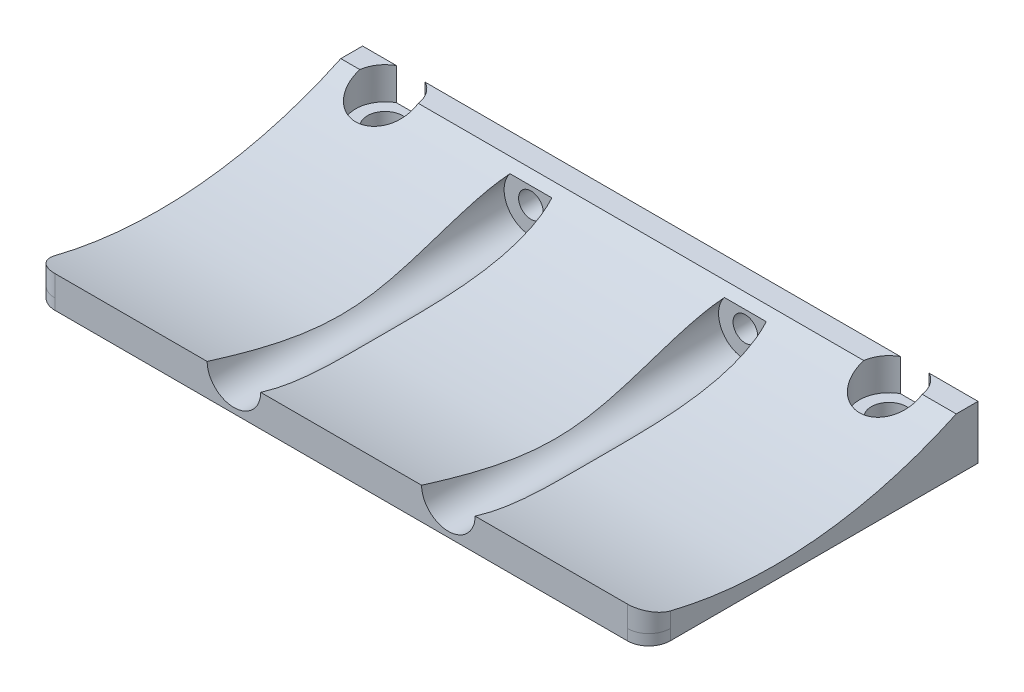
from build123d import *

# Parameters (mm, degrees)
SKETCH1_W           = 57.4
SKETCH1_H           = 33
SKETCH1_R           = 1.65
BOSS_EXTRUDE1_DEPTH = 1
CUT_EXTRUDE1_REACH  = 68.218
SKETCH2_W           = 57.4
SKETCH2_H           = 2.3
BOSS_EXTRUDE2_DEPTH = 57.4
FILLET1_R           = 2
BOSS_EXTRUDE3_DEPTH = 57.4
SKETCH4_R           = 1.65
CUT_EXTRUDE2_DEPTH  = 2
CUT_EXTRUDE3_REACH  = 67.163
SKETCH5_R           = 2.75
SKETCH6_R           = 1.15
CUT_EXTRUDE4_DEPTH  = 3
SKETCH9_R           = 2.5
CUT_EXTRUDE5_DEPTH  = 64.930040028
FILLET2_R           = 2


with BuildPart() as part:
    # Sketch1 → Boss-Extrude1 (new body)
    with BuildSketch(Plane(origin=(0, 0, 0), x_dir=(1, 0, 0), z_dir=(0, 1, 0))):
        with Locations((28.7, 16.5)):
            Rectangle(SKETCH1_W, SKETCH1_H)
        with Locations(Location((4.5, 28.3, 0), (0, 0, 270))):
            Circle(SKETCH1_R, mode=Mode.SUBTRACT)
        with Locations(Location((51.5, 28.3, 0), (0, 0, 270))):
            Circle(SKETCH1_R, mode=Mode.SUBTRACT)
        with Locations(Location((4.5, 4.7, 0), (0, 0, 270))):
            Circle(SKETCH1_R, mode=Mode.SUBTRACT)
        with Locations(Location((51.5, 4.7, 0), (0, 0, 270))):
            Circle(SKETCH1_R, mode=Mode.SUBTRACT)
    extrude(amount=BOSS_EXTRUDE1_DEPTH)

    # Sketch2 → Cut-Extrude1 (cut, up to next)
    with BuildSketch(Plane(origin=(0, 1, 0), x_dir=(1, 0, 0), z_dir=(0, 1, 0)), mode=Mode.PRIVATE) as cut_extrude1_sk1:
        with Locations((28.7, 31.85)):
            Rectangle(SKETCH2_W, SKETCH2_H)
    cut_extrude1_tool1 = extrude(cut_extrude1_sk1.sketch, amount=-CUT_EXTRUDE1_REACH, mode=Mode.PRIVATE) & part.part
    add(cut_extrude1_tool1.solids().sort_by_distance((28.7, 1, -31.85))[0], mode=Mode.SUBTRACT)

    # Sketch3 → Boss-Extrude2 (add)
    with BuildSketch(Plane(origin=(57.4, 0, 0), x_dir=(0, 0, -1), z_dir=(1, 0, 0))):
        Polygon((30.7, 1), (30.7, 5), (28.7, 5), (20.7, 1), align=None)
    extrude(amount=-BOSS_EXTRUDE2_DEPTH)

    # Fillet1
    fillet1_edges = [part.edges().sort_by_distance(p)[0] for p in [
        (57.4, 0.5, 0),
        (0, 0.5, 0),
    ]]
    fillet(fillet1_edges, radius=FILLET1_R)

    # Sketch10 → Boss-Extrude3 (add)
    with BuildSketch(Plane(origin=(0, 0, 0), x_dir=(0, 0, -1), z_dir=(1, 0, 0))):
        with BuildLine():
            Line((0, 1), (2, 1))
            Line((2, 1), (20.7, 1))
            Line((20.7, 1), (28.7, 5))
            Line((28.7, 5), (28.668697288, 5))
            ThreePointArc((28.668697288, 5), (14.522580868, 1.323329002), (0, 2.974136187))
            Line((0, 2.974136187), (0, 1))
        make_face()
    extrude(amount=BOSS_EXTRUDE3_DEPTH)

    # Sketch4 → Cut-Extrude2 (cut)
    with BuildSketch(Plane(origin=(0, 0, 0), x_dir=(-1, 0, 0), z_dir=(0, -1, 0))):
        with Locations(Location((-4.5, 28.3, 0), (0, 0, 90))):
            Circle(SKETCH4_R)
        with Locations(Location((-51.5, 28.3, 0), (0, 0, 90))):
            Circle(SKETCH4_R)
    extrude(amount=-CUT_EXTRUDE2_DEPTH, mode=Mode.SUBTRACT)

    # Sketch5 → Cut-Extrude3 (cut, up to next)
    with BuildSketch(Plane(origin=(0, 2, 0), x_dir=(-1, 0, 0), z_dir=(0, -1, 0)), mode=Mode.PRIVATE) as cut_extrude3_sk1:
        with Locations((-4.5, 28.3)):
            Circle(SKETCH5_R)
    cut_extrude3_tool1 = extrude(cut_extrude3_sk1.sketch, amount=-CUT_EXTRUDE3_REACH, mode=Mode.PRIVATE) & part.part
    # Sketch5 → Cut-Extrude3 (cut, up to next)
    with BuildSketch(Plane(origin=(0, 2, 0), x_dir=(-1, 0, 0), z_dir=(0, -1, 0)), mode=Mode.PRIVATE) as cut_extrude3_sk2:
        with Locations((-51.5, 28.3)):
            Circle(SKETCH5_R)
    cut_extrude3_tool2 = extrude(cut_extrude3_sk2.sketch, amount=-CUT_EXTRUDE3_REACH, mode=Mode.PRIVATE) & part.part
    add(cut_extrude3_tool1.solids().sort_by_distance((4.5, 2, -28.3))[0], mode=Mode.SUBTRACT)
    add(cut_extrude3_tool2.solids().sort_by_distance((51.5, 2, -28.3))[0], mode=Mode.SUBTRACT)

    # Sketch6 → Cut-Extrude4 (cut)
    with BuildSketch(Plane(origin=(0, 0, -30.7), x_dir=(-1, 0, 0), z_dir=(0, 0, -1))):
        with Locations((-38.7, 3)):
            Circle(SKETCH6_R)
        with Locations((-18.7, 3)):
            Circle(SKETCH6_R)
    extrude(amount=-CUT_EXTRUDE4_DEPTH, mode=Mode.SUBTRACT)

    # Sketch9 → Cut-Extrude5 (cut, through all)
    with BuildSketch(Plane(origin=(0, 0, -27.7), x_dir=(-1, 0, 0), z_dir=(0, 0, -1))):
        with Locations((-38.7, 3)):
            Circle(SKETCH9_R)
        with Locations((-18.7, 3)):
            Circle(SKETCH9_R)
    extrude(amount=-CUT_EXTRUDE5_DEPTH, mode=Mode.SUBTRACT)

    # Fillet2
    fillet2_edges = [part.edges().sort_by_distance(p)[0] for p in [
        (0, 1.987068094, 0),
        (57.4, 1.987068094, 0),
    ]]
    fillet(fillet2_edges, radius=FILLET2_R)


solid = part.part
